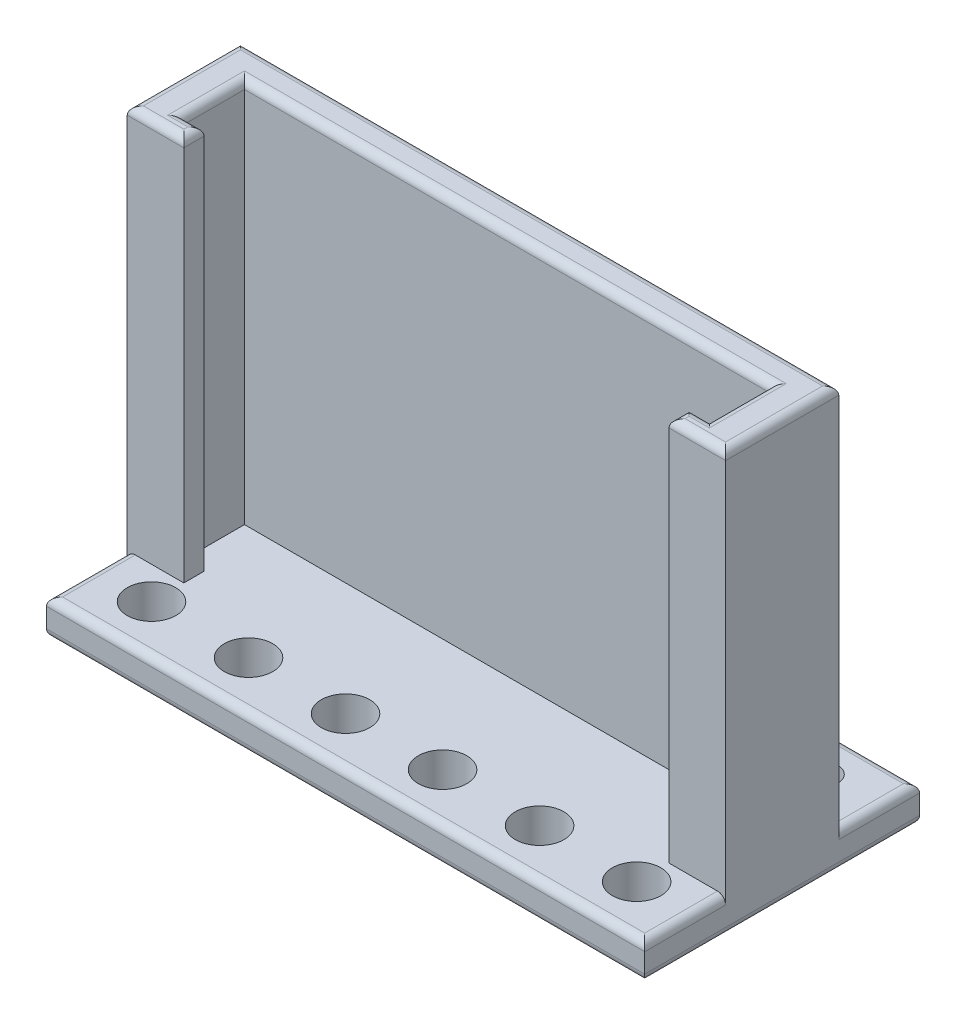
from build123d import *

# Parameters (mm, degrees)
SKETCH2_W           = 93.98
SKETCH2_H           = 66.04
BOSS_EXTRUDE1_DEPTH = 17.78
SKETCH3_W           = 93.98
SKETCH3_H           = 5.588
BOSS_EXTRUDE2_DEPTH = 12.7
SKETCH4_W           = 82.55
SKETCH4_H           = 9.525
SKETCH4_W_2         = 76.2
SKETCH4_H_2         = 3.175
CUT_EXTRUDE1_DEPTH  = 60.452
SKETCH5_W           = 93.98
SKETCH5_H           = 5.588
BOSS_EXTRUDE3_DEPTH = 12.7
SKETCH6_R           = 2.413
SKETCH6_R_2         = 3.81
CUT_EXTRUDE2_DEPTH  = 116.826228049
FILLET1_R           = 1.27
FILLET2_R           = 1.27
FILLET3_R           = 1.27


with BuildPart() as part:
    # Sketch2 → Boss-Extrude1 (new body)
    with BuildSketch(Plane.XY):
        with Locations((46.99, 33.02)):
            Rectangle(SKETCH2_W, SKETCH2_H)
    extrude(amount=BOSS_EXTRUDE1_DEPTH)

    # Sketch3 → Boss-Extrude2 (add)
    with BuildSketch(Plane.XY.offset(17.78)):
        with Locations((46.99, 2.794)):
            Rectangle(SKETCH3_W, SKETCH3_H)
    extrude(amount=BOSS_EXTRUDE2_DEPTH)

    # Sketch4 → Cut-Extrude1 (cut)
    with BuildSketch(Plane(origin=(0, 66.04, 0), x_dir=(1, 0, 0), z_dir=(0, 1, 0))):
        with Locations((46.99, -9.8425)):
            Rectangle(SKETCH4_W, SKETCH4_H)
        with Locations((46.99, -16.1925)):
            Rectangle(SKETCH4_W_2, SKETCH4_H_2)
    extrude(amount=-CUT_EXTRUDE1_DEPTH, mode=Mode.SUBTRACT)

    # Sketch5 → Boss-Extrude3 (add)
    with BuildSketch(Plane(origin=(0, 0, 0), x_dir=(-1, 0, 0), z_dir=(0, 0, -1))):
        with Locations((-46.99, 2.794)):
            Rectangle(SKETCH5_W, SKETCH5_H)
    extrude(amount=BOSS_EXTRUDE3_DEPTH)

    # Sketch6 → Cut-Extrude2 (cut, through all)
    with BuildSketch(Plane(origin=(0, 5.588, 0), x_dir=(1, 0, 0), z_dir=(0, 1, 0))):
        with Locations(Location((8.89, 6.35, 0), (0, 0, 270))):
            Circle(SKETCH6_R)
        with Locations(Location((21.59, 6.35, 0), (0, 0, 270))):
            Circle(SKETCH6_R)
        with Locations(Location((34.29, 6.35, 0), (0, 0, 270))):
            Circle(SKETCH6_R)
        with Locations(Location((46.99, 6.35, 0), (0, 0, 270))):
            Circle(SKETCH6_R)
        with Locations(Location((59.69, 6.35, 0), (0, 0, 270))):
            Circle(SKETCH6_R)
        with Locations(Location((72.39, 6.35, 0), (0, 0, 270))):
            Circle(SKETCH6_R)
        with Locations(Location((85.09, 6.35, 0), (0, 0, 270))):
            Circle(SKETCH6_R)
        with Locations(Location((8.89, -22.86, 0), (0, 0, 270))):
            Circle(SKETCH6_R_2)
        with Locations(Location((24.13, -22.86, 0), (0, 0, 270))):
            Circle(SKETCH6_R_2)
        with Locations(Location((39.37, -22.86, 0), (0, 0, 270))):
            Circle(SKETCH6_R_2)
        with Locations(Location((54.61, -22.86, 0), (0, 0, 270))):
            Circle(SKETCH6_R_2)
        with Locations(Location((69.85, -22.86, 0), (0, 0, 270))):
            Circle(SKETCH6_R_2)
        with Locations(Location((85.09, -22.86, 0), (0, 0, 270))):
            Circle(SKETCH6_R_2)
    extrude(amount=-CUT_EXTRUDE2_DEPTH, mode=Mode.SUBTRACT)

    # Fillet1
    fillet1_edges = [part.edges().sort_by_distance(p)[0] for p in [
        (89.535, 66.04, 17.78),
        (4.445, 66.04, 17.78),
        (88.265, 66.04, 9.8425),
        (46.99, 66.04, 5.08),
        (5.715, 66.04, 9.8425),
        (7.3025, 66.04, 14.605),
        (8.89, 66.04, 16.1925),
        (86.6775, 66.04, 14.605),
        (85.09, 66.04, 16.1925),
        (46.99, 66.04, 0),
        (0, 66.04, 8.89),
        (93.98, 66.04, 8.89),
    ]]
    fillet(fillet1_edges, radius=FILLET1_R)

    # Fillet2
    fillet2_edges = [part.edges().sort_by_distance(p)[0] for p in [
        (0, 5.588, 24.13),
        (93.98, 5.588, 24.13),
        (46.99, 5.588, 30.48),
        (93.98, 5.588, -6.35),
        (0, 5.588, -6.35),
        (46.99, 5.588, -12.7),
    ]]
    fillet(fillet2_edges, radius=FILLET2_R)

    # Fillet3
    fillet3_edges = [part.edges().sort_by_distance(p)[0] for p in [
        (46.99, 0, 30.48),
        (46.99, 0, -12.7),
        (93.98, 0, 8.89),
        (0, 0, 8.89),
    ]]
    fillet(fillet3_edges, radius=FILLET3_R)


solid = part.part
